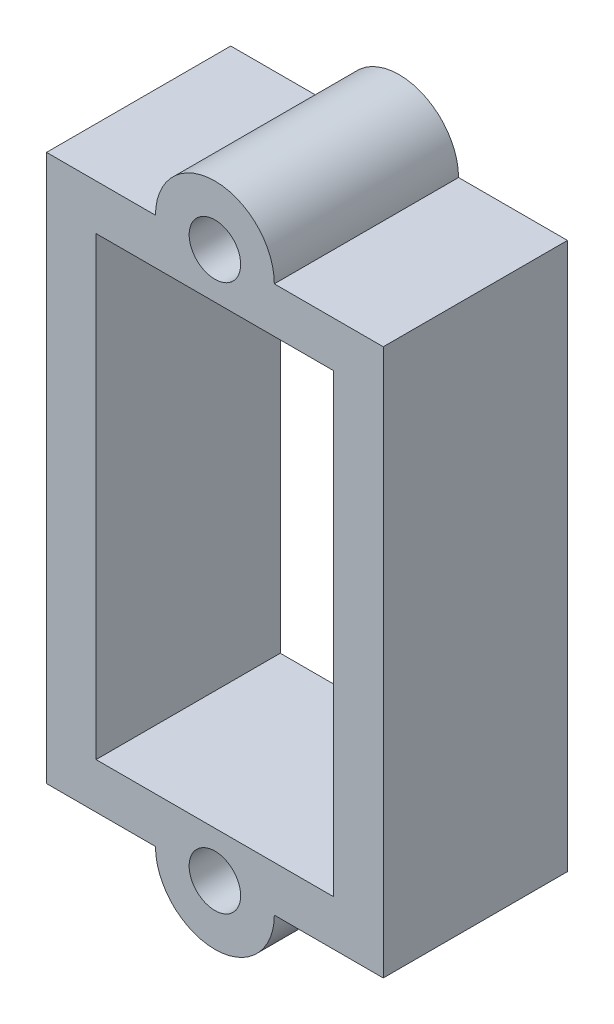
from build123d import *

# Parameters (mm, degrees)
SKETCH1_R           = 1.3
SKETCH1_W           = 12
SKETCH1_H           = 23
BOSS_EXTRUDE1_DEPTH = 9.3


with BuildPart() as part:
    # Sketch1 → Boss-Extrude1 (new body)
    with BuildSketch(Plane.XY):
        with BuildLine():
            Line((-3, 13.8), (-8.5, 13.8))
            Line((-8.5, 13.8), (-8.5, -13.8))
            Line((-8.5, -13.8), (-3, -13.8))
            ThreePointArc((-3, -13.8), (0, -16.8), (3, -13.8))
            Line((3, -13.8), (8.5, -13.8))
            Line((8.5, -13.8), (8.5, 13.8))
            Line((8.5, 13.8), (3, 13.8))
            ThreePointArc((3, 13.8), (0, 16.8), (-3, 13.8))
        make_face()
        with Locations((0, 13.8)):
            Circle(SKETCH1_R, mode=Mode.SUBTRACT)
        with Locations((0, -13.8)):
            Circle(SKETCH1_R, mode=Mode.SUBTRACT)
        Rectangle(SKETCH1_W, SKETCH1_H, mode=Mode.SUBTRACT)
    extrude(amount=BOSS_EXTRUDE1_DEPTH)


solid = part.part
